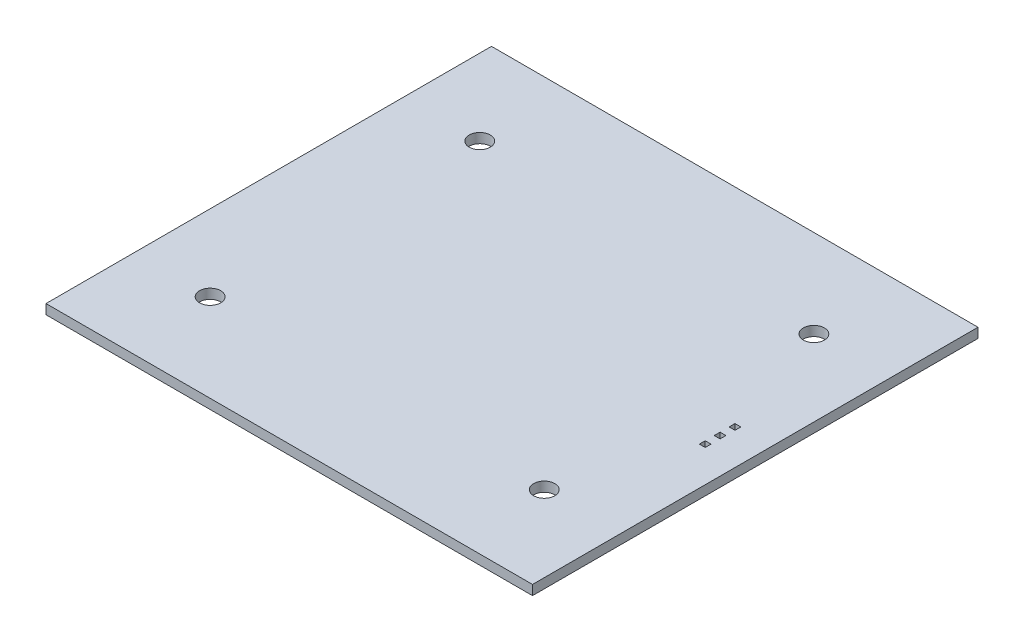
from build123d import *

# Parameters (mm, degrees)
SKETCH2_W            = 83
SKETCH2_H            = 76
BOSS_EXTRUDE1_DEPTH  = 1.66
SKETCH3_W            = 1
SKETCH3_H            = 1
CUT_EXTRUDE1_DEPTH   = 113.551124384
M3_CLEARANCE_HOLE2_D = 3.6


with BuildPart() as part:
    # Sketch2 → Boss-Extrude1 (new body)
    with BuildSketch(Plane(origin=(0, 0, 0), x_dir=(1, 0, 0), z_dir=(0, 1, 0))):
        with Locations((41.5, 38)):
            Rectangle(SKETCH2_W, SKETCH2_H)
    extrude(amount=BOSS_EXTRUDE1_DEPTH)

    # Sketch3 → Cut-Extrude1 (cut, through all)
    with BuildSketch(Plane(origin=(0, 1.66, 0), x_dir=(1, 0, 0), z_dir=(0, 1, 0))):
        with Locations((77, 38)):
            Rectangle(SKETCH3_W, SKETCH3_H)
        with Locations((77, 40.54)):
            Rectangle(SKETCH3_W, SKETCH3_H)
        with Locations((77, 35.46)):
            Rectangle(SKETCH3_W, SKETCH3_H)
    extrude(amount=-CUT_EXTRUDE1_DEPTH, mode=Mode.SUBTRACT)

    # M3 Clearance Hole2 (through all)
    with Locations(Plane(origin=(0, 1.66, 0), x_dir=(1, 0, 0), z_dir=(0, 1, 0))):
        with Locations((13, 61), (70, 61), (70, 15), (13, 15)):
            Hole(M3_CLEARANCE_HOLE2_D / 2)


solid = part.part
